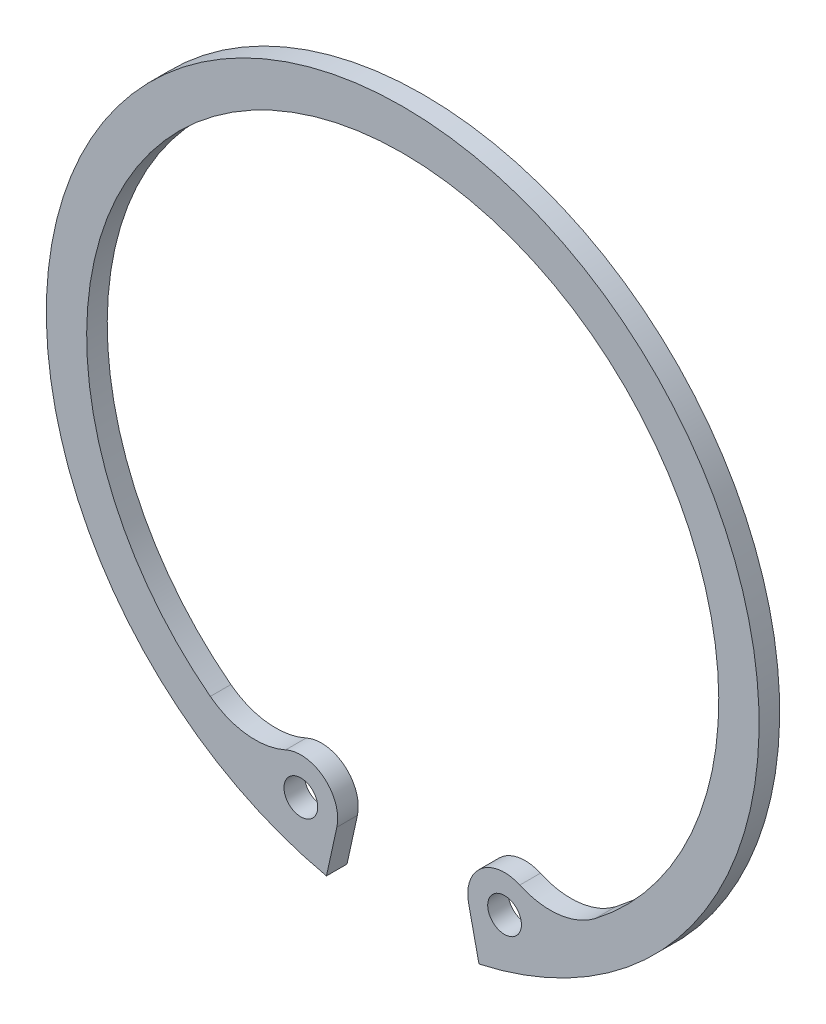
from build123d import *

# Parameters (mm, degrees)
BODYSKE_R  = 0.5207
BODY_DEPTH = 0.635


with BuildPart() as part:
    # BodySke → Body (new body)
    with BuildSketch(Plane.XY):
        with BuildLine():
            Line((2.353587579, -10.745260607), (2.033396527, -9.283434273))
            ThreePointArc((2.033396527, -9.283434273), (2.429101401, -8.156328823), (3.614087191, -8.005472202))
            ThreePointArc((3.614087191, -8.005472202), (4.813247885, -8.19451157), (5.938711245, -7.739479176))
            ThreePointArc((5.938711245, -7.739479176), (0, 9.7554), (-5.938711245, -7.739479176))
            ThreePointArc((-5.938711245, -7.739479176), (-4.813247885, -8.19451157), (-3.614087191, -8.005472202))
            ThreePointArc((-3.614087191, -8.005472202), (-2.429101401, -8.156328823), (-2.033396527, -9.283434273))
            Line((-2.033396527, -9.283434273), (-2.353587579, -10.745260607))
            ThreePointArc((-2.353587579, -10.745260607), (0, 11), (2.353587579, -10.745260607))
        make_face()
        with Locations((3.143723842, -9.040233789)):
            Circle(BODYSKE_R, mode=Mode.SUBTRACT)
        with Locations((-3.143723842, -9.040233789)):
            Circle(BODYSKE_R, mode=Mode.SUBTRACT)
    extrude(amount=-BODY_DEPTH)


solid = part.part
